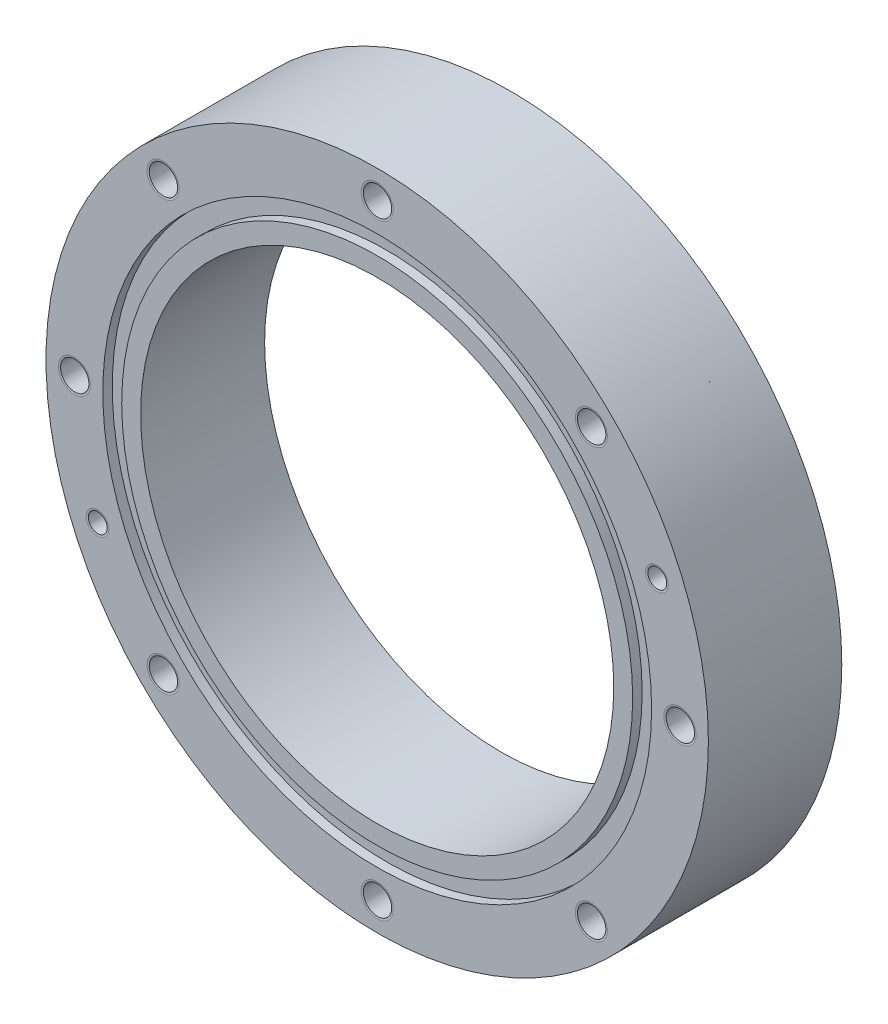
from build123d import *

# Parameters (mm, degrees)
CROQUIS1_R              = 35
CROQUIS1_R_2            = 1.5
CROQUIS1_R_3            = 29
SALIENTE_EXTRUIR3_DEPTH = 14.1
CROQUIS4_R              = 29
CROQUIS4_R_2            = 25
SALIENTE_EXTRUIR4_DEPTH = 14.1
CROQUIS5_R              = 29
CORTAR_EXTRUIR1_DEPTH   = 1.1
CORTAR_EXTRUIR1_DRAFT   = -76
SALIENTE_EXTRUIR5_START = -3.1
CROQUIS6_R              = 29
CROQUIS6_R_2            = 25
SALIENTE_EXTRUIR5_DEPTH = 3.1
CROQUIS7_R              = 29
CROQUIS7_R_2            = 27
CORTAR_EXTRUIR2_DEPTH   = 1
CROQUIS11_R             = 1
CORTAR_EXTRUIR5_DEPTH   = 4


with BuildPart() as part:
    # Croquis1 → Saliente-Extruir3 (new body)
    with BuildSketch(Plane.XY):
        Circle(CROQUIS1_R)
        with Locations((0, 32)):
            Circle(CROQUIS1_R_2, mode=Mode.SUBTRACT)
        with Locations((22.627416998, 22.627416998)):
            Circle(CROQUIS1_R_2, mode=Mode.SUBTRACT)
        with Locations((32, 0)):
            Circle(CROQUIS1_R_2, mode=Mode.SUBTRACT)
        with Locations((22.627416998, -22.627416998)):
            Circle(CROQUIS1_R_2, mode=Mode.SUBTRACT)
        with Locations((0, -32)):
            Circle(CROQUIS1_R_2, mode=Mode.SUBTRACT)
        with Locations((-22.627416998, -22.627416998)):
            Circle(CROQUIS1_R_2, mode=Mode.SUBTRACT)
        with Locations((-32, 0)):
            Circle(CROQUIS1_R_2, mode=Mode.SUBTRACT)
        with Locations((-22.627416998, 22.627416998)):
            Circle(CROQUIS1_R_2, mode=Mode.SUBTRACT)
        Circle(CROQUIS1_R_3, mode=Mode.SUBTRACT)
    extrude(amount=SALIENTE_EXTRUIR3_DEPTH)



with BuildPart() as body_2:
    # Croquis4 → Saliente-Extruir4 (new body)
    with BuildSketch(Plane(origin=(0, 0, 0), x_dir=(-1, 0, 0), z_dir=(0, 0, -1))):
        with Locations(Location((0, 0, 0), (0, 0, 180))):
            Circle(CROQUIS4_R)
        Circle(CROQUIS4_R_2, mode=Mode.SUBTRACT)
    extrude(amount=-SALIENTE_EXTRUIR4_DEPTH)


with BuildPart() as cortar_extruir1_tool:
    # Croquis5 → Cortar-Extruir1 (with draft: the straight prism first)
    with BuildSketch(Plane(origin=(0, 0, 0), x_dir=(-1, 0, 0), z_dir=(0, 0, -1))):
        with Locations(Location((0, 0, 0), (0, 0, 180))):
            Circle(CROQUIS5_R)
    extrude(amount=-CORTAR_EXTRUIR1_DEPTH)
    # Cortar-Extruir1: the draft: its side faces are tilted about the plane it starts from
    cortar_extruir1_sides = [cortar_extruir1_tool.faces().sort_by_distance(p)[0] for p in [
        (-29, 0, 0.55),
    ]]
    draft(cortar_extruir1_sides, Plane(origin=(0, 0, 0), x_dir=(-1, 0, 0), z_dir=(0, 0, -1)), CORTAR_EXTRUIR1_DRAFT)


with BuildPart() as body_2_1:
    add(body_2.part)

    # Cortar-Extruir1: cut by cortar_extruir1_tool
    add(cortar_extruir1_tool.part, mode=Mode.SUBTRACT)


with BuildPart() as part_1:
    add(part.part)

    add(body_2_1.part)  # Saliente-Extruir5 merges body 2
    # Croquis6 → Saliente-Extruir5 (add)
    with BuildSketch(Plane.XY.offset(14.1).offset(SALIENTE_EXTRUIR5_START)):
        Circle(CROQUIS6_R)
        Circle(CROQUIS6_R_2, mode=Mode.SUBTRACT)
    extrude(amount=SALIENTE_EXTRUIR5_DEPTH)

    # Croquis7 → Cortar-Extruir2 (cut)
    with BuildSketch(Plane.XY.offset(14.1)):
        Circle(CROQUIS7_R)
        Circle(CROQUIS7_R_2, mode=Mode.SUBTRACT)
    extrude(amount=-CORTAR_EXTRUIR2_DEPTH, mode=Mode.SUBTRACT)

    # Cortar-Extruir3 cone 1 section (through the dimple's axis) → Cortar-Extruir3 (revolve, cut)
    with BuildSketch(Plane(origin=(0, 32, 0), x_dir=(0, 1, 0), z_dir=(1, 0, 0))):
        Polygon((0, 0), (1.7, 0), (0, 0.299755867), align=None)
    revolve(axis=Axis((0, 32, 0), (0, 0, 1)), mode=Mode.SUBTRACT)

    # Cortar-Extruir3 cone 2 section (through the dimple's axis) → Cortar-Extruir3 cone 2 (revolve, cut)
    with BuildSketch(Plane(origin=(-22.627416998, 22.627416998, 0), x_dir=(0, 1, 0), z_dir=(1, 0, 0))):
        Polygon((0, 0), (1.7, 0), (0, 0.299755867), align=None)
    revolve(axis=Axis((-22.627416998, 22.627416998, 0), (0, 0, 1)), mode=Mode.SUBTRACT)

    # Cortar-Extruir3 cone 3 section (through the dimple's axis) → Cortar-Extruir3 cone 3 (revolve, cut)
    with BuildSketch(Plane.YZ.offset(-32)):
        Polygon((0, 0), (1.7, 0), (0, 0.299755867), align=None)
    revolve(axis=Axis((-32, 0, 0), (0, 0, 1)), mode=Mode.SUBTRACT)

    # Cortar-Extruir3 cone 4 section (through the dimple's axis) → Cortar-Extruir3 cone 4 (revolve, cut)
    with BuildSketch(Plane(origin=(-22.627416998, -22.627416998, 0), x_dir=(0, 1, 0), z_dir=(1, 0, 0))):
        Polygon((0, 0), (1.7, 0), (0, 0.299755867), align=None)
    revolve(axis=Axis((-22.627416998, -22.627416998, 0), (0, 0, 1)), mode=Mode.SUBTRACT)

    # Cortar-Extruir3 cone 5 section (through the dimple's axis) → Cortar-Extruir3 cone 5 (revolve, cut)
    with BuildSketch(Plane(origin=(0, -32, 0), x_dir=(0, 1, 0), z_dir=(1, 0, 0))):
        Polygon((0, 0), (1.7, 0), (0, 0.299755867), align=None)
    revolve(axis=Axis((0, -32, 0), (0, 0, 1)), mode=Mode.SUBTRACT)

    # Cortar-Extruir3 cone 6 section (through the dimple's axis) → Cortar-Extruir3 cone 6 (revolve, cut)
    with BuildSketch(Plane(origin=(22.627416998, -22.627416998, 0), x_dir=(0, 1, 0), z_dir=(1, 0, 0))):
        Polygon((0, 0), (1.7, 0), (0, 0.299755867), align=None)
    revolve(axis=Axis((22.627416998, -22.627416998, 0), (0, 0, 1)), mode=Mode.SUBTRACT)

    # Cortar-Extruir3 cone 7 section (through the dimple's axis) → Cortar-Extruir3 cone 7 (revolve, cut)
    with BuildSketch(Plane.YZ.offset(32)):
        Polygon((0, 0), (1.7, 0), (0, 0.299755867), align=None)
    revolve(axis=Axis((32, 0, 0), (0, 0, 1)), mode=Mode.SUBTRACT)

    # Cortar-Extruir3 cone 8 section (through the dimple's axis) → Cortar-Extruir3 cone 8 (revolve, cut)
    with BuildSketch(Plane(origin=(22.627416998, 22.627416998, 0), x_dir=(0, 1, 0), z_dir=(1, 0, 0))):
        Polygon((0, 0), (1.7, 0), (0, 0.299755867), align=None)
    revolve(axis=Axis((22.627416998, 22.627416998, 0), (0, 0, 1)), mode=Mode.SUBTRACT)

    # Cortar-Extruir4 cone 1 section (through the dimple's axis) → Cortar-Extruir4 (revolve, cut)
    with BuildSketch(Plane(origin=(0, 32, 14.1), x_dir=(0, -1, 0), z_dir=(1, 0, 0))):
        Polygon((0, 0), (1.7, 0), (0, 0.299755867), align=None)
    revolve(axis=Axis((0, 32, 14.1), (0, 0, -1)), mode=Mode.SUBTRACT)

    # Cortar-Extruir4 cone 2 section (through the dimple's axis) → Cortar-Extruir4 cone 2 (revolve, cut)
    with BuildSketch(Plane(origin=(22.627416998, 22.627416998, 14.1), x_dir=(0, -1, 0), z_dir=(1, 0, 0))):
        Polygon((0, 0), (1.7, 0), (0, 0.299755867), align=None)
    revolve(axis=Axis((22.627416998, 22.627416998, 14.1), (0, 0, -1)), mode=Mode.SUBTRACT)

    # Cortar-Extruir4 cone 3 section (through the dimple's axis) → Cortar-Extruir4 cone 3 (revolve, cut)
    with BuildSketch(Plane(origin=(32, 0, 14.1), x_dir=(0, -1, 0), z_dir=(1, 0, 0))):
        Polygon((0, 0), (1.7, 0), (0, 0.299755867), align=None)
    revolve(axis=Axis((32, 0, 14.1), (0, 0, -1)), mode=Mode.SUBTRACT)

    # Cortar-Extruir4 cone 4 section (through the dimple's axis) → Cortar-Extruir4 cone 4 (revolve, cut)
    with BuildSketch(Plane(origin=(22.627416998, -22.627416998, 14.1), x_dir=(0, -1, 0), z_dir=(1, 0, 0))):
        Polygon((0, 0), (1.7, 0), (0, 0.299755867), align=None)
    revolve(axis=Axis((22.627416998, -22.627416998, 14.1), (0, 0, -1)), mode=Mode.SUBTRACT)

    # Cortar-Extruir4 cone 5 section (through the dimple's axis) → Cortar-Extruir4 cone 5 (revolve, cut)
    with BuildSketch(Plane(origin=(0, -32, 14.1), x_dir=(0, -1, 0), z_dir=(1, 0, 0))):
        Polygon((0, 0), (1.7, 0), (0, 0.299755867), align=None)
    revolve(axis=Axis((0, -32, 14.1), (0, 0, -1)), mode=Mode.SUBTRACT)

    # Cortar-Extruir4 cone 6 section (through the dimple's axis) → Cortar-Extruir4 cone 6 (revolve, cut)
    with BuildSketch(Plane(origin=(-22.627416998, -22.627416998, 14.1), x_dir=(0, -1, 0), z_dir=(1, 0, 0))):
        Polygon((0, 0), (1.7, 0), (0, 0.299755867), align=None)
    revolve(axis=Axis((-22.627416998, -22.627416998, 14.1), (0, 0, -1)), mode=Mode.SUBTRACT)

    # Cortar-Extruir4 cone 7 section (through the dimple's axis) → Cortar-Extruir4 cone 7 (revolve, cut)
    with BuildSketch(Plane(origin=(-32, 0, 14.1), x_dir=(0, -1, 0), z_dir=(1, 0, 0))):
        Polygon((0, 0), (1.7, 0), (0, 0.299755867), align=None)
    revolve(axis=Axis((-32, 0, 14.1), (0, 0, -1)), mode=Mode.SUBTRACT)

    # Cortar-Extruir4 cone 8 section (through the dimple's axis) → Cortar-Extruir4 cone 8 (revolve, cut)
    with BuildSketch(Plane(origin=(-22.627416998, 22.627416998, 14.1), x_dir=(0, -1, 0), z_dir=(1, 0, 0))):
        Polygon((0, 0), (1.7, 0), (0, 0.299755867), align=None)
    revolve(axis=Axis((-22.627416998, 22.627416998, 14.1), (0, 0, -1)), mode=Mode.SUBTRACT)

    # Croquis11 → Cortar-Extruir5 (cut)
    with BuildSketch(Plane.XY.offset(14.1)):
        with Locations((29.56414504, 12.245869836)):
            Circle(CROQUIS11_R)
        with Locations((-29.56414504, -12.245869836)):
            Circle(CROQUIS11_R)
    extrude(amount=-CORTAR_EXTRUIR5_DEPTH, mode=Mode.SUBTRACT)

    # Cortar-Extruir6 cone 1 section (through the dimple's axis) → Cortar-Extruir6 (revolve, cut)
    with BuildSketch(Plane(origin=(29.56414504, 12.245869836, 14.1), x_dir=(0, -1, 0), z_dir=(1, 0, 0))):
        Polygon((0, 0), (1.2, 0), (0, 0.211592377), align=None)
    revolve(axis=Axis((29.56414504, 12.245869836, 14.1), (0, 0, -1)), mode=Mode.SUBTRACT)

    # Cortar-Extruir6 cone 2 section (through the dimple's axis) → Cortar-Extruir6 cone 2 (revolve, cut)
    with BuildSketch(Plane(origin=(-29.56414504, -12.245869836, 14.1), x_dir=(0, -1, 0), z_dir=(1, 0, 0))):
        Polygon((0, 0), (1.2, 0), (0, 0.211592377), align=None)
    revolve(axis=Axis((-29.56414504, -12.245869836, 14.1), (0, 0, -1)), mode=Mode.SUBTRACT)


solid = part_1.part
